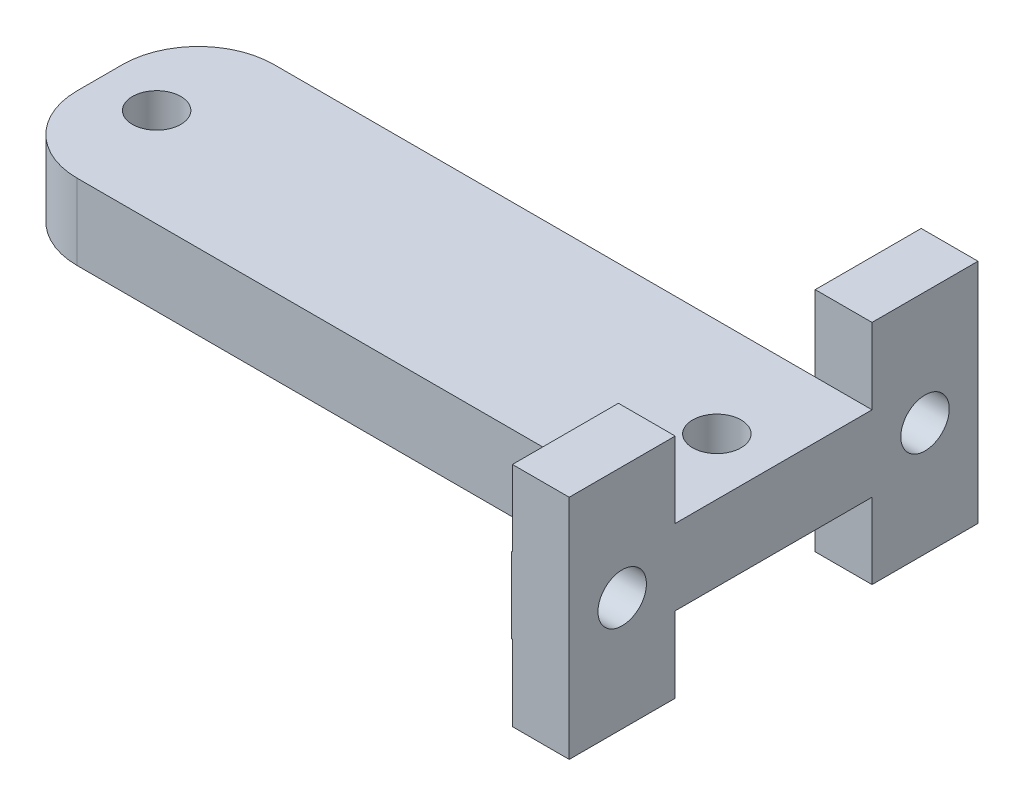
from build123d import *

# Parameters (mm, degrees)
SKETCH_1_W          = 100
SKETCH_1_H          = 100
EXTRUDE_1_DEPTH     = 10
CUT_EXTRUDE_3_DEPTH = 27
CUT_EXTRUDE_4_DEPTH = 27
SKETCH_5_R          = 1.6
CUT_EXTRUDE_5_DEPTH = 27
SKETCH_6_W          = 37
SKETCH_6_H          = 5
SKETCH_6_W_2        = 7.5
CUT_EXTRUDE_6_DEPTH = 27
SKETCH_8_W          = 3.805881933
SKETCH_8_H          = 5
EXTRUDE_2_DEPTH     = 7
SKETCH_10_W         = 3.75
SKETCH_10_H         = 5
EXTRUDE_3_DEPTH     = 7
FILLET_1_R          = 5
FILLET_2_R          = 5
SKETCH_14_W         = 7
SKETCH_14_H         = 5
EXTRUDE_6_DEPTH     = 3.750003
CUT_EXTRUDE_START   = -3.805882
CUT_EXTRUDE_8_DEPTH = 3.805882


with BuildPart() as part:
    # 草图1 → 凸台-拉伸1 (new body)
    with BuildSketch(Plane(origin=(0, 0, 0), x_dir=(1, 0, 0), z_dir=(0, 1, 0))):
        with Locations((50, -50)):
            Rectangle(SKETCH_1_W, SKETCH_1_H)
    extrude(amount=EXTRUDE_1_DEPTH)

    # 草图2 → 切除-拉伸3 (cut)
    with BuildSketch(Plane(origin=(0, 10, 0), x_dir=(1, 0, 0), z_dir=(0, 1, 0))):
        Polygon((50.15455276, -13), (20.65455276, -13), (0, -13), (0, -100), (100, -100), (100, -13), align=None)
    extrude(amount=-CUT_EXTRUDE_3_DEPTH, mode=Mode.SUBTRACT)

    # 草图4 → 切除-拉伸4 (cut)
    with BuildSketch(Plane(origin=(0, 10, 0), x_dir=(1, 0, 0), z_dir=(0, 1, 0))):
        Polygon((13.15455276, -13), (13.15455276, -6.5), (13.15455276, 0), (0, 0), (0, -13), align=None)
        Polygon((100, 0), (57.65455276, 0), (57.65455276, -6.5), (57.65455276, -13), (100, -13), align=None)
    extrude(amount=-CUT_EXTRUDE_4_DEPTH, mode=Mode.SUBTRACT)

    # 草图5 → 切除-拉伸5 (cut)
    with BuildSketch(Plane(origin=(0, 10, 0), x_dir=(1, 0, 0), z_dir=(0, 1, 0))):
        with Locations(Location((16.90455276, -6.5, 0), (0, 0, 270))):
            Circle(SKETCH_5_R)
        with Locations(Location((53.90455276, -6.5, 0), (0, 0, 270))):
            Circle(SKETCH_5_R)
    extrude(amount=-CUT_EXTRUDE_5_DEPTH, mode=Mode.SUBTRACT)

    # 草图6 → 切除-拉伸6 (cut)
    with BuildSketch(Plane.XY.offset(13)):
        with Locations((31.65455276, 2.5)):
            Rectangle(SKETCH_6_W, SKETCH_6_H)
        with Locations((53.90455276, 2.5)):
            Rectangle(SKETCH_6_W_2, SKETCH_6_H)
    extrude(amount=-CUT_EXTRUDE_6_DEPTH, mode=Mode.SUBTRACT)

    # 草图8 → 凸台-拉伸2 (add)
    with BuildSketch(Plane.XY.offset(13)):
        with Locations((55.751611794, 7.5)):
            Rectangle(SKETCH_8_W, SKETCH_8_H)
    extrude(amount=EXTRUDE_2_DEPTH)

    # 草图10 → 凸台-拉伸3 (add)
    with BuildSketch(Plane(origin=(0, 0, 0), x_dir=(-1, 0, 0), z_dir=(0, 0, -1))):
        with Locations((-55.77955276, 7.5)):
            Rectangle(SKETCH_10_W, SKETCH_10_H)
    extrude(amount=EXTRUDE_3_DEPTH)

    # 圆角1
    fillet_1_edges = [part.edges().sort_by_distance(p)[0] for p in [
        (13.15455276, 7.5, 0),
    ]]
    fillet(fillet_1_edges, radius=FILLET_1_R)

    # 圆角2
    fillet_2_edges = [part.edges().sort_by_distance(p)[0] for p in [
        (13.15455276, 7.5, 13),
    ]]
    fillet(fillet_2_edges, radius=FILLET_2_R)

    # 草图14 → 凸台-拉伸6 (add)
    with BuildSketch(Plane(origin=(57.65455276, 0, 0), x_dir=(0, 0, -1), z_dir=(1, 0, 0))):
        with Locations((-16.5, 12.5)):
            Rectangle(SKETCH_14_W, SKETCH_14_H)
        with Locations((-16.5, 2.5)):
            Rectangle(SKETCH_14_W, SKETCH_14_H)
        with Locations((3.5, 12.5)):
            Rectangle(SKETCH_14_W, SKETCH_14_H)
        with Locations((3.5, 2.5)):
            Rectangle(SKETCH_14_W, SKETCH_14_H)
    extrude(amount=-EXTRUDE_6_DEPTH)

    # 草图15 → 切除-拉伸8 (cut)
    with BuildSketch(Plane.ZY.offset(-53.848670827).offset(CUT_EXTRUDE_START)):
        with BuildLine():
            ThreePointArc((-1.9, 7.5), (-1.976327186, 7.98828389), (-2.198026446, 8.42998111))
            Line((-2.198026446, 8.42998111), (-4.801973554, 6.57001889))
            ThreePointArc((-4.801973554, 6.57001889), (-3.01171611, 5.976327186), (-1.9, 7.5))
        make_face()
        with BuildLine():
            Line((-4.801973554, 6.57001889), (-2.198026446, 8.42998111))
            ThreePointArc((-2.198026446, 8.42998111), (-4.42998111, 8.801973554), (-4.801973554, 6.57001889))
        make_face()
        with BuildLine():
            ThreePointArc((18.1, 7.5), (16.98828389, 9.023672814), (15.198026446, 8.42998111))
            Line((15.198026446, 8.42998111), (17.801973554, 6.57001889))
            ThreePointArc((17.801973554, 6.57001889), (18.023672814, 7.01171611), (18.1, 7.5))
        make_face()
        with BuildLine():
            Line((17.801973554, 6.57001889), (15.198026446, 8.42998111))
            ThreePointArc((15.198026446, 8.42998111), (15.57001889, 6.198026446), (17.801973554, 6.57001889))
        make_face()
    extrude(amount=CUT_EXTRUDE_8_DEPTH, mode=Mode.SUBTRACT)


solid = part.part
